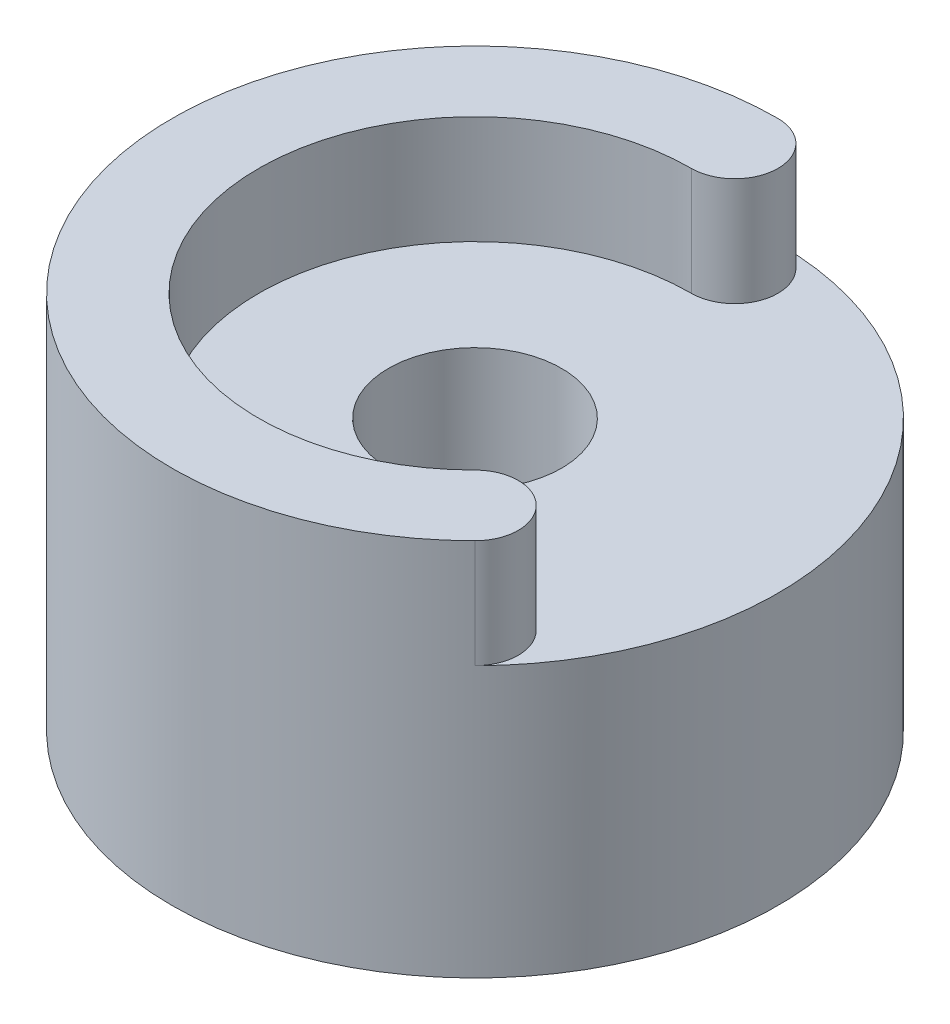
from build123d import *

# Parameters (mm, degrees)
SKETCH5_R           = 14
SKETCH5_R_2         = 4
BOSS_EXTRUDE3_DEPTH = 12.5
BOSS_EXTRUDE4_DEPTH = 5


with BuildPart() as part:
    # Sketch5 → Boss-Extrude3 (new body)
    with BuildSketch(Plane(origin=(0, 0, 0), x_dir=(1, 0, 0), z_dir=(0, 1, 0))):
        with Locations(Location((0, 0, 0), (0, 0, 270))):
            Circle(SKETCH5_R)
        with Locations(Location((0, 0, 0), (0, 0, 270))):
            Circle(SKETCH5_R_2, mode=Mode.SUBTRACT)
    extrude(amount=BOSS_EXTRUDE3_DEPTH)

    # Sketch6 → Boss-Extrude4 (add)
    with BuildSketch(Plane(origin=(0, 12.5, 0), x_dir=(1, 0, 0), z_dir=(0, 1, 0))):
        with BuildLine():
            ThreePointArc((0, 14), (-12.934313455, -5.357568053), (9.899494937, -9.899494937))
            ThreePointArc((9.899494937, -9.899494937), (9.899494937, -7.071067812), (7.071067812, -7.071067812))
            ThreePointArc((7.071067812, -7.071067812), (-9.238795325, -3.826834324), (0, 10))
            ThreePointArc((0, 10), (2, 12), (0, 14))
        make_face()
    extrude(amount=BOSS_EXTRUDE4_DEPTH)


solid = part.part
